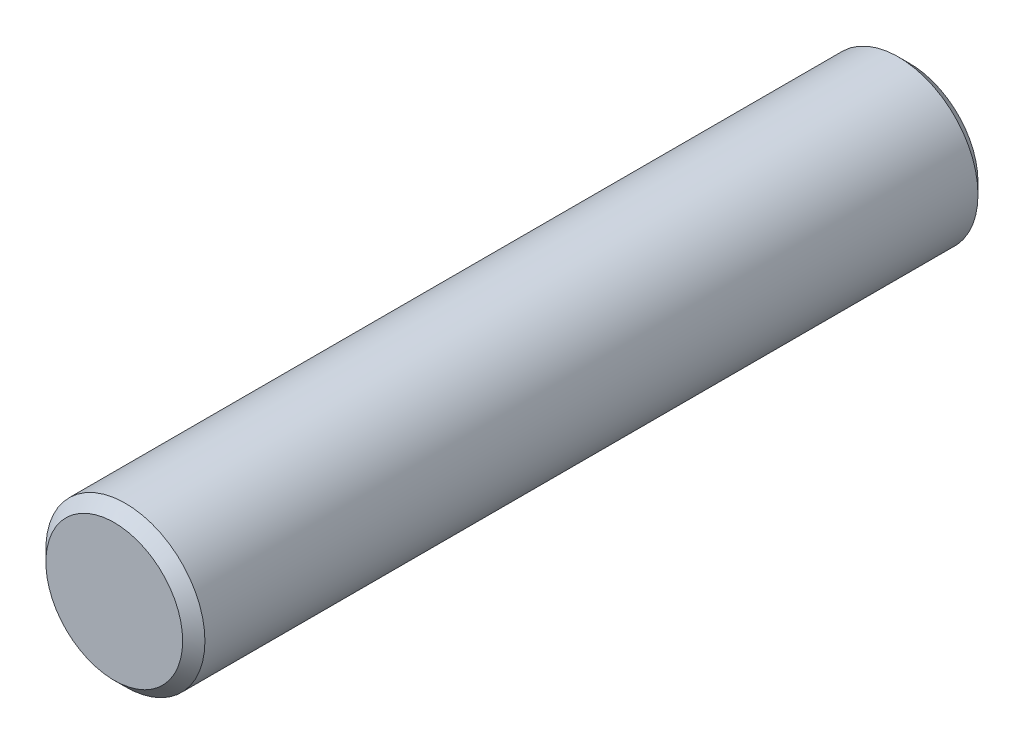
from build123d import *

# Parameters (mm, degrees)
SKICA1_R        = 1.5
VYSUNOUT1_DEPTH = 15
ZKOSIT1_SIZE    = 0.21


with BuildPart() as part:
    # Skica1 → Vysunout1 (new body)
    with BuildSketch(Plane.XY):
        Circle(SKICA1_R)
    extrude(amount=VYSUNOUT1_DEPTH)

    # Zkosit1
    zkosit1_edges = [part.edges().sort_by_distance(p)[0] for p in [
        (-1.5, 0, 0),
        (-1.5, 0, 15),
    ]]
    chamfer(zkosit1_edges, length=ZKOSIT1_SIZE)


solid = part.part
